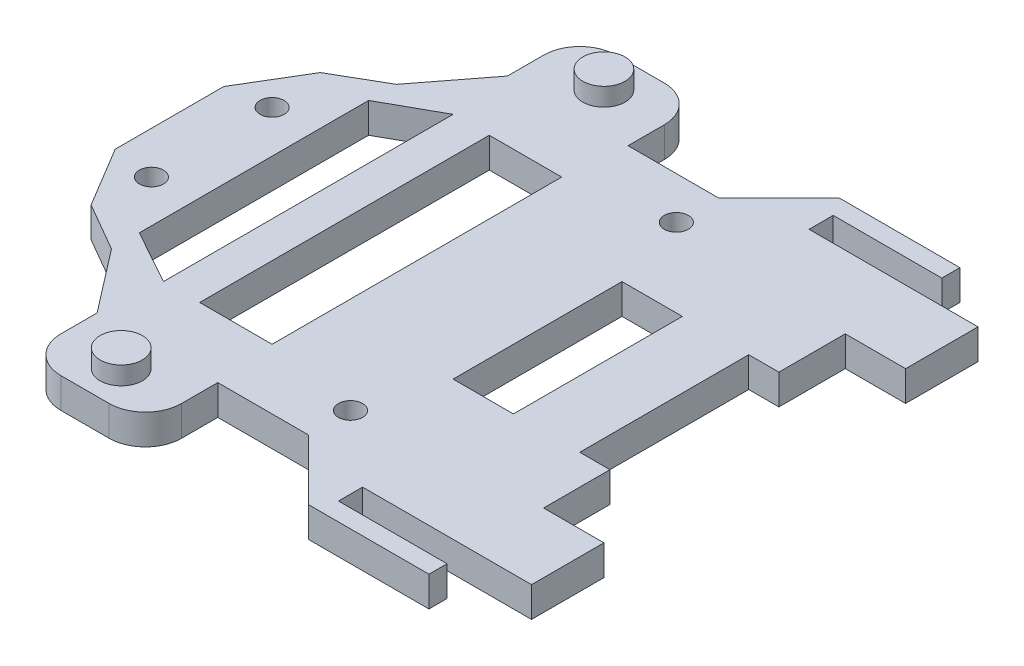
from build123d import *

# Parameters (mm, degrees)
SKETCH1_R           = 2
SKETCH1_W           = 12
SKETCH1_H           = 48
SKETCH1_W_2         = 10
SKETCH1_H_2         = 28
BOSS_EXTRUDE1_DEPTH = 5
SKETCH1_3_R         = 3.5
BOSS_EXTRUDE2_DEPTH = 8


with BuildPart() as part:
    # Sketch1 → Boss-Extrude1 (new body)
    with BuildSketch(Plane(origin=(0, 0, 0), x_dir=(1, 0, 0), z_dir=(0, 1, 0))):
        with BuildLine():
            Line((0, 9), (0, -9))
            Line((0, -9), (6, -19))
            Line((6, -19), (14, -23.618802154))
            Line((14, -23.618802154), (22, -34))
            Line((22, -34), (22, -40))
            ThreePointArc((22, -40), (23.757359313, -44.242640687), (28, -46))
            Line((28, -46), (36, -46))
            ThreePointArc((36, -46), (40.242640687, -44.242640687), (42, -40))
            Line((42, -40), (42, -34))
            Line((42, -34), (57, -34))
            Line((57, -34), (67, -44))
            Line((67, -44), (87, -44))
            Line((87, -44), (87, -41))
            Line((87, -41), (69, -41))
            Line((69, -41), (69, -37))
            Line((69, -37), (97, -37))
            Line((97, -37), (97, -25))
            Line((97, -25), (87, -25))
            Line((87, -25), (87, -14))
            Line((87, -14), (82, -14))
            Line((82, -14), (82, 14))
            Line((82, 14), (87, 14))
            Line((87, 14), (87, 25))
            Line((87, 25), (97, 25))
            Line((97, 25), (97, 37))
            Line((97, 37), (69, 37))
            Line((69, 37), (69, 41))
            Line((69, 41), (87, 41))
            Line((87, 41), (87, 44))
            Line((87, 44), (67, 44))
            Line((67, 44), (57, 34))
            Line((57, 34), (42, 34))
            Line((42, 34), (42, 40))
            ThreePointArc((42, 40), (40.242640687, 44.242640687), (36, 46))
            Line((36, 46), (28, 46))
            ThreePointArc((28, 46), (23.757359313, 44.242640687), (22, 40))
            Line((22, 40), (22, 34))
            Line((22, 34), (14, 23.618802154))
            Line((14, 23.618802154), (6, 19))
            Line((6, 19), (0, 9))
        make_face()
        with Locations((7, -10)):
            Circle(SKETCH1_R, mode=Mode.SUBTRACT)
        with Locations((57, -27)):
            Circle(SKETCH1_R, mode=Mode.SUBTRACT)
        with Locations((7, 10)):
            Circle(SKETCH1_R, mode=Mode.SUBTRACT)
        Polygon((14, -19), (14, 19), (23, 24), (23, -24), align=None, mode=Mode.SUBTRACT)
        with Locations((35, 0)):
            Rectangle(SKETCH1_W, SKETCH1_H, mode=Mode.SUBTRACT)
        with Locations((66, 0)):
            Rectangle(SKETCH1_W_2, SKETCH1_H_2, mode=Mode.SUBTRACT)
        with Locations((57, 27)):
            Circle(SKETCH1_R, mode=Mode.SUBTRACT)
    extrude(amount=BOSS_EXTRUDE1_DEPTH)

    # Sketch1<3> → Boss-Extrude2 (add)
    with BuildSketch(Plane(origin=(0, 0, 0), x_dir=(1, 0, 0), z_dir=(0, 1, 0))):
        with Locations((32, -40)):
            Circle(SKETCH1_3_R)
        with Locations((32, 40)):
            Circle(SKETCH1_3_R)
    extrude(amount=BOSS_EXTRUDE2_DEPTH)


solid = part.part
